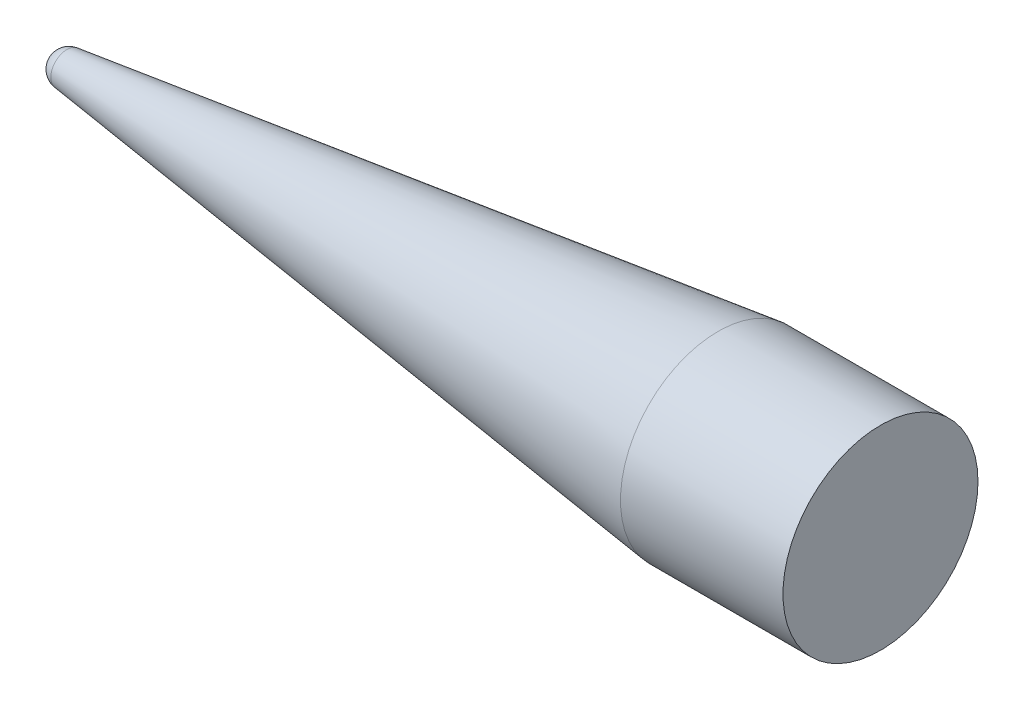
from build123d import *

# Parameters (mm, degrees)
SKETCH2_R           = 76.2
BOSS_EXTRUDE1_DEPTH = 127


with BuildPart() as part:
    # Sketch1 → Revolve3 (revolve)
    with BuildSketch(Plane(origin=(0, 0, 0), x_dir=(1, 0, 0), z_dir=(0, 1, 0))):
        with BuildLine():
            Line((89.690673402, 0), (609.6, 0))
            Line((609.6, 0), (609.6, 76.2))
            Line((609.6, 76.2), (100.815432273, 12.601929034))
            ThreePointArc((100.815432273, 12.601929034), (92.869760569, 8.404892553), (89.690673402, 0))
        make_face()
    revolve(axis=Axis((89.690673402, 0, 0), (1, 0, 0)))

    # Sketch2 → Boss-Extrude1 (add)
    with BuildSketch(Plane(origin=(609.6, 0, 0), x_dir=(0, 0, -1), z_dir=(1, 0, 0))):
        Circle(SKETCH2_R)
    extrude(amount=BOSS_EXTRUDE1_DEPTH)


solid = part.part
